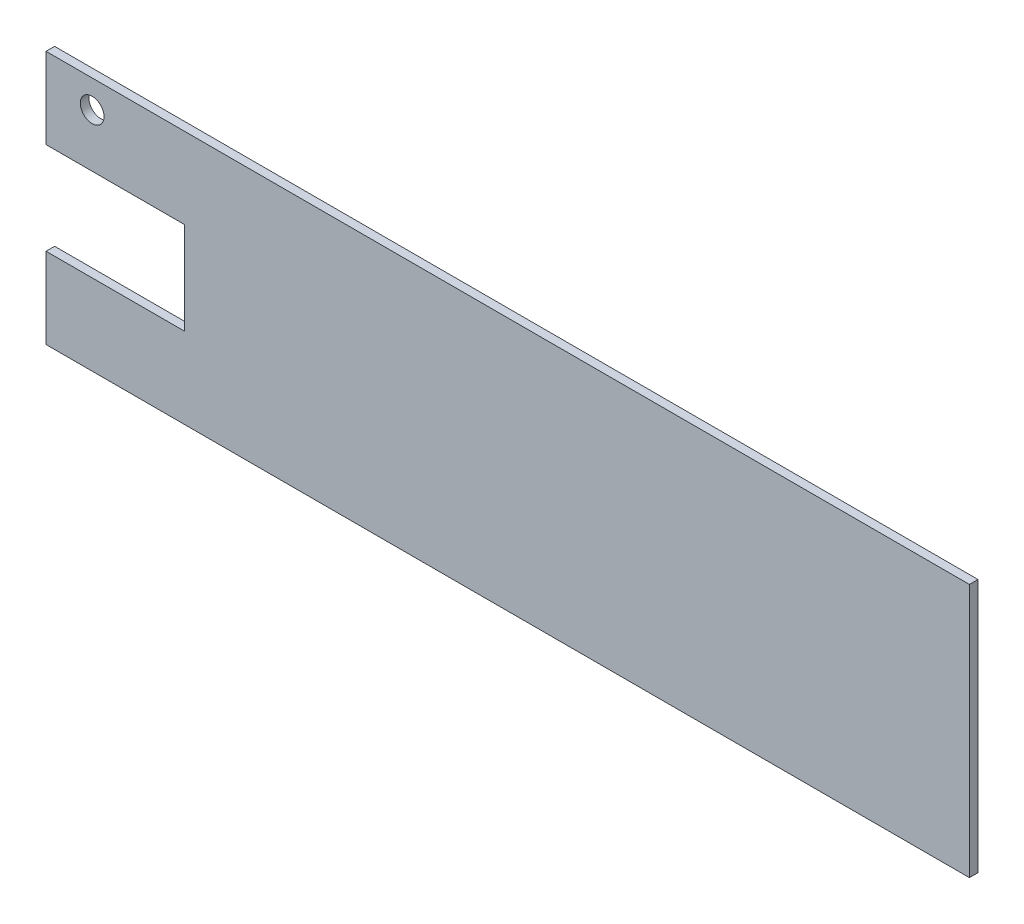
from build123d import *

# Parameters (mm, degrees)
SKETCH1_W           = 254
SKETCH1_H           = 69.85
BOSS_EXTRUDE1_DEPTH = 2.3622
SKETCH2_W           = 38.1
SKETCH2_H           = 25.4
CUT_EXTRUDE1_DEPTH  = 264.439940952
SKETCH3_R           = 3.2639
CUT_EXTRUDE2_DEPTH  = 264.439940952


with BuildPart() as part:
    # Sketch1 → Boss-Extrude1 (new body)
    with BuildSketch(Plane.XY):
        with Locations((127, 34.925)):
            Rectangle(SKETCH1_W, SKETCH1_H)
    extrude(amount=BOSS_EXTRUDE1_DEPTH)

    # Sketch2 → Cut-Extrude1 (cut, through all)
    with BuildSketch(Plane.XY.offset(2.3622)):
        with Locations((19.05, 34.925)):
            Rectangle(SKETCH2_W, SKETCH2_H)
    extrude(amount=-CUT_EXTRUDE1_DEPTH, mode=Mode.SUBTRACT)

    # Sketch3 → Cut-Extrude2 (cut, through all)
    with BuildSketch(Plane.XY.offset(2.3622)):
        with Locations((12.7, 62.23)):
            Circle(SKETCH3_R)
    extrude(amount=-CUT_EXTRUDE2_DEPTH, mode=Mode.SUBTRACT)


solid = part.part
